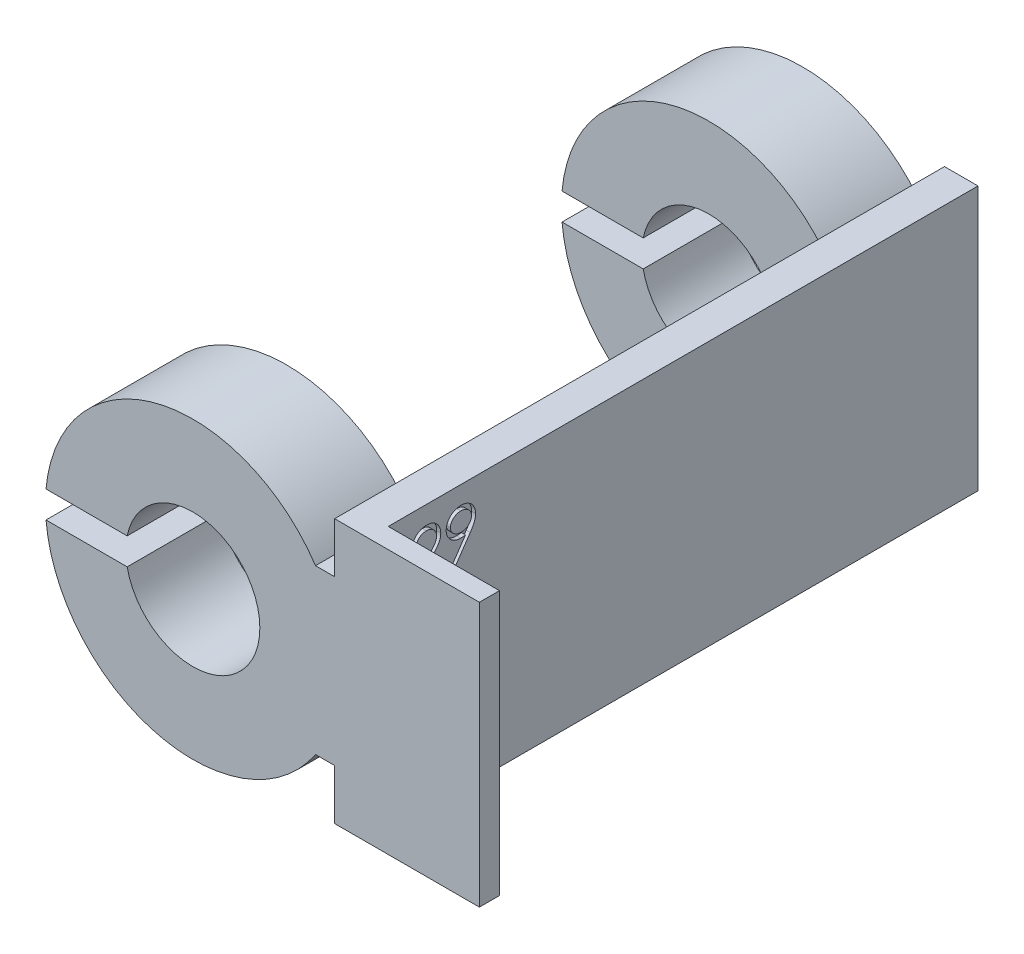
from build123d import *

# Parameters (mm, degrees)
BOSS_EXTRUDE1_DEPTH = 7
SKETCH4_W           = 8.3
SKETCH4_H           = 5.5
CUT_EXTRUDE1_DEPTH  = 24
SKETCH5_W           = 2.5
SKETCH5_H           = 38.5
BOSS_EXTRUDE2_DEPTH = 19.7
BOSS_EXTRUDE3_DEPTH = 7
CUT_EXTRUDE2_DEPTH  = 0.3


with BuildPart() as part:
    # Sketch1 → Boss-Extrude1 (new body)
    with BuildSketch(Plane.XY):
        with BuildLine():
            Line((9.153687781, 6.1), (10.58, 6.1))
            Line((10.58, 6.1), (10.58, 9.85))
            Line((10.58, 9.85), (21.38, 9.85))
            Line((21.38, 9.85), (21.38, -9.85))
            Line((21.38, -9.85), (10.58, -9.85))
            Line((10.58, -9.85), (10.58, -6.1))
            Line((10.58, -6.1), (9.153687781, -6.1))
            ThreePointArc((9.153687781, -6.1), (-2.704290513, -10.662401832), (-10.95445115, -1))
            Line((-10.95445115, -1), (-4.898979486, -1))
            ThreePointArc((-4.898979486, -1), (5, 0), (-4.898979486, 1))
            Line((-4.898979486, 1), (-10.95445115, 1))
            ThreePointArc((-10.95445115, 1), (-2.704290513, 10.662401832), (9.153687781, 6.1))
        make_face()
    extrude(amount=BOSS_EXTRUDE1_DEPTH)

    # Sketch4 → Cut-Extrude1 (cut)
    with BuildSketch(Plane.XZ.offset(9.85)):
        with Locations((17.23, 2.75)):
            Rectangle(SKETCH4_W, SKETCH4_H)
    extrude(amount=-CUT_EXTRUDE1_DEPTH, mode=Mode.SUBTRACT)

    # Sketch5 → Boss-Extrude2 (add)
    with BuildSketch(Plane.XZ.offset(9.85)):
        with Locations((11.83, -19.25)):
            Rectangle(SKETCH5_W, SKETCH5_H)
    extrude(amount=-BOSS_EXTRUDE2_DEPTH)

    # Sketch7 → Boss-Extrude3 (add)
    with BuildSketch(Plane(origin=(0, 0, -38.5), x_dir=(-1, 0, 0), z_dir=(0, 0, -1))):
        with BuildLine():
            Line((-10.58, 6.1), (-10.58, -6.1))
            Line((-10.58, -6.1), (-9.153687781, -6.1))
            ThreePointArc((-9.153687781, -6.1), (2.704290513, -10.662401832), (10.95445115, -1))
            Line((10.95445115, -1), (4.898979486, -1))
            ThreePointArc((4.898979486, -1), (-5, 0), (4.898979486, 1))
            Line((4.898979486, 1), (10.95445115, 1))
            ThreePointArc((10.95445115, 1), (2.704290513, 10.662401832), (-9.153687781, 6.1))
            Line((-9.153687781, 6.1), (-10.58, 6.1))
        make_face()
    extrude(amount=-BOSS_EXTRUDE3_DEPTH)

    # Sketch8 → Cut-Extrude2 (cut)
    # profile 1 of 2: a face of its own
    with BuildSketch(Plane(origin=(13.08, 0, 0), x_dir=(0, 0, -1), z_dir=(1, 0, 0))):
        with BuildLine():
            Line((-3.466201583, 7.336697768), (-3.780304148, 7.336697768))
            add(Edge.make_bspline(
                [(-3.780304148, 7.336697768), (-3.778256995, 7.378368656), (-3.77423644, 7.46020917), (-3.755408151, 7.579533077), (-3.728467274, 7.693587875), (-3.69037582, 7.801457789), (-3.643069542, 7.904096596), (-3.586339515, 8.001096612), (-3.519145664, 8.092087801), (-3.44293893, 8.176226644), (-3.360170291, 8.253414215), (-3.270864352, 8.320069458), (-3.177019324, 8.376387129), (-3.078919926, 8.423468371), (-2.975459362, 8.458808217), (-2.867576504, 8.485029856), (-2.754797368, 8.500806202), (-2.677957346, 8.502501988), (-2.638877865, 8.503364434)],
                knots=[0, 0, 0, 0, 1.10065271, 2.161652631, 3.183658789, 4.190468796, 5.17591951, 6.163126047, 7.15150782, 8.156236427, 9.156009102, 10.134482811, 11.092018607, 12.041330605, 13.001268258, 13.972401359, 14.968799086, 16, 16, 16, 16], degree=3))
            add(Edge.make_bspline(
                [(-2.638877865, 8.503364434), (-2.600499791, 8.502465978), (-2.525088247, 8.500700543), (-2.415026232, 8.485539514), (-2.310248938, 8.461793922), (-2.210961171, 8.428478506), (-2.117955107, 8.383694079), (-2.030532062, 8.32989654), (-1.947651251, 8.267676709), (-1.873044468, 8.194422895), (-1.804536389, 8.116220511), (-1.745434133, 8.032732607), (-1.69482097, 7.946503321), (-1.65263329, 7.85687512), (-1.621577151, 7.763004091), (-1.597998943, 7.666256889), (-1.584671529, 7.565632078), (-1.582626106, 7.497525522), (-1.581586199, 7.462899691)],
                knots=[0, 0, 0, 0, 1.111607364, 2.184268762, 3.212621178, 4.221274766, 5.211760367, 6.196651075, 7.1921475, 8.207485113, 9.220403448, 10.201281604, 11.166441695, 12.114753415, 13.065576456, 14.026450734, 14.996634279, 16, 16, 16, 16], degree=3))
            add(Edge.make_bspline(
                [(-1.581586199, 7.462899691), (-1.583279462, 7.414151856), (-1.586636273, 7.317511643), (-1.61535065, 7.17549678), (-1.660197161, 7.037903361), (-1.714194518, 6.927166059), (-1.768666962, 6.837932565), (-1.817754469, 6.76446386), (-1.87521928, 6.685358392), (-1.941897778, 6.600881054), (-2.01641065, 6.510370149), (-2.099432814, 6.413880354), (-2.191556296, 6.312408584), (-2.256214796, 6.243102983), (-2.289719212, 6.207190556)],
                knots=[0, 0, 0, 0, 1.184426356, 2.348067706, 3.509069118, 4.696110526, 5.333549288, 6.050745305, 6.844228056, 7.710549037, 8.667450064, 9.695053472, 10.805634456, 12, 12, 12, 12], degree=3))
            Line((-2.289719212, 6.207190556), (-3.165420333, 5.272595204))
            Line((-3.165420333, 5.272595204), (-1.536714404, 5.272595204))
            Line((-1.536714404, 5.272595204), (-1.536714404, 4.913620845))
            Line((-1.536714404, 4.913620845), (-3.914919532, 4.913620845))
            Line((-3.914919532, 4.913620845), (-2.557547737, 6.362138473))
            add(Edge.make_bspline(
                [(-2.557547737, 6.362138473), (-2.52449985, 6.396636779), (-2.461021623, 6.462900966), (-2.371239047, 6.559643926), (-2.290600058, 6.649393467), (-2.218582665, 6.731980015), (-2.15674916, 6.808611583), (-2.101876928, 6.876806287), (-2.057911337, 6.939560737), (-2.010195941, 7.012301351), (-1.96398196, 7.101113668), (-1.924269604, 7.209647357), (-1.900054756, 7.32137461), (-1.89714992, 7.396876647), (-1.895688763, 7.434854819)],
                knots=[0, 0, 0, 0, 1.329631726, 2.553950428, 3.673215718, 4.687767853, 5.603093632, 6.413772471, 7.123043292, 7.734684054, 8.834405432, 9.900288307, 10.943827018, 12, 12, 12, 12], degree=3))
            add(Edge.make_bspline(
                [(-1.895688763, 7.434854819), (-1.896324505, 7.458736217), (-1.897577431, 7.505801868), (-1.908635129, 7.574807627), (-1.925345635, 7.641372441), (-1.949290893, 7.70570106), (-1.980897633, 7.767146712), (-2.019371013, 7.825784192), (-2.063761076, 7.882473157), (-2.115112346, 7.935626455), (-2.171523865, 7.984307661), (-2.231118115, 8.027431746), (-2.294168219, 8.063470857), (-2.360408341, 8.093014354), (-2.429653811, 8.116189735), (-2.502038556, 8.132248315), (-2.577362572, 8.142330799), (-2.628796068, 8.143694971), (-2.655003667, 8.144390075)],
                knots=[0, 0, 0, 0, 0.991446411, 1.95395049, 2.89581595, 3.838931463, 4.798493298, 5.75982156, 6.748411868, 7.785213223, 8.824556874, 9.840280684, 10.836137867, 11.835679398, 12.848801643, 13.863922112, 14.911575587, 16, 16, 16, 16], degree=3))
            add(Edge.make_bspline(
                [(-2.655003667, 8.144390075), (-2.6823745, 8.143675043), (-2.736126296, 8.142270838), (-2.815045329, 8.132448174), (-2.890331106, 8.115502334), (-2.962173009, 8.092325659), (-3.030692595, 8.06286711), (-3.095556639, 8.026175366), (-3.156619528, 7.982391872), (-3.213996052, 7.932751316), (-3.266860031, 7.877483715), (-3.313306907, 7.815873752), (-3.353890921, 7.749046337), (-3.389300154, 7.677181786), (-3.418055844, 7.599628006), (-3.440028995, 7.516660301), (-3.457415841, 7.42863892), (-3.463224362, 7.367853835), (-3.466201583, 7.336697768)],
                knots=[0, 0, 0, 0, 1.031018746, 2.02475058, 2.990194455, 3.934040569, 4.864654155, 5.795059489, 6.735614925, 7.690564532, 8.649604399, 9.611025574, 10.590972636, 11.591080095, 12.624614302, 13.701020113, 14.821632451, 16, 16, 16, 16], degree=3))
        make_face()
    # profile 2 of 2: a face of its own
    with BuildSketch(Plane(origin=(13.08, 0, 0), x_dir=(0, 0, -1), z_dir=(1, 0, 0))):
        with BuildLine():
            Line((-0.459791327, 4.823877255), (-0.71079293, 4.998456582))
            Line((-0.71079293, 4.998456582), (0.262364122, 6.421032704))
            add(Edge.make_bspline(
                [(0.262364122, 6.421032704), (0.200273386, 6.41343964), (0.078013266, 6.398488475), (-0.045123836, 6.395741821), (-0.105724821, 6.394390075)],
                knots=[0, 0, 0, 0, 1.015715272, 2, 2, 2, 2], degree=3))
            add(Edge.make_bspline(
                [(-0.105724821, 6.394390075), (-0.142466868, 6.395331152), (-0.214588295, 6.397178403), (-0.320619948, 6.411820211), (-0.422505508, 6.434370339), (-0.519974864, 6.468019094), (-0.613394369, 6.509837303), (-0.702560082, 6.561694317), (-0.787351973, 6.622700608), (-0.866859383, 6.6925336), (-0.939171122, 6.769211652), (-1.00359442, 6.850367295), (-1.057135552, 6.936943266), (-1.101612137, 7.027173485), (-1.135342591, 7.122354836), (-1.159905128, 7.221404236), (-1.175027482, 7.325015878), (-1.176826578, 7.395541009), (-1.177740045, 7.43134921)],
                knots=[0, 0, 0, 0, 1.060718605, 2.082097864, 3.085795603, 4.069760067, 5.054557537, 6.03741023, 7.043284206, 8.066802108, 9.088538119, 10.083643548, 11.053783639, 12.022749082, 12.983451788, 13.964007469, 14.966251758, 16, 16, 16, 16], degree=3))
            add(Edge.make_bspline(
                [(-1.177740045, 7.43134921), (-1.17600561, 7.480317863), (-1.172601267, 7.576433394), (-1.145202749, 7.716867163), (-1.10014241, 7.849653707), (-1.037314033, 7.974443901), (-0.958179312, 8.08944264), (-0.863070722, 8.193051249), (-0.752566757, 8.283796103), (-0.629184738, 8.361800181), (-0.495831718, 8.424535178), (-0.356163059, 8.470774478), (-0.211248939, 8.497973226), (-0.113081269, 8.501559087), (-0.063657513, 8.503364434)],
                knots=[0, 0, 0, 0, 1.022988612, 2.007919123, 2.978103895, 3.94594894, 4.918897164, 5.887013414, 6.875921846, 7.89917871, 8.930658928, 9.948724884, 10.967259574, 12, 12, 12, 12], degree=3))
            add(Edge.make_bspline(
                [(-0.063657513, 8.503364434), (-0.015169093, 8.501534271), (0.080639454, 8.497918042), (0.22152846, 8.471434073), (0.356469477, 8.4267974), (0.484714464, 8.365112836), (0.603453876, 8.287791928), (0.710229687, 8.195657405), (0.802605226, 8.088651877), (0.880429107, 7.969363387), (0.942899147, 7.841196406), (0.98797143, 7.707412484), (1.015717069, 7.568973762), (1.019213396, 7.475179288), (1.020977904, 7.427843601)],
                knots=[0, 0, 0, 0, 1.026385292, 2.028040595, 3.023318987, 4.028184125, 5.03290303, 6.015178782, 7.004435299, 8.016004309, 9.023023918, 10.015172535, 10.998308025, 12, 12, 12, 12], degree=3))
            add(Edge.make_bspline(
                [(1.020977904, 7.427843601), (1.019799495, 7.391099834), (1.017409387, 7.316574293), (1.00067308, 7.20334395), (0.972252895, 7.087892721), (0.940001196, 6.990171125), (0.908869028, 6.909462675), (0.879567897, 6.845711096), (0.847055743, 6.778609832), (0.809136978, 6.708862494), (0.768374681, 6.635579959), (0.722315404, 6.559497244), (0.672009833, 6.48051225), (0.636180113, 6.427265162), (0.617832872, 6.39999905)],
                knots=[0, 0, 0, 0, 1.179839688, 2.393009684, 3.667231171, 4.993948276, 5.694988576, 6.444077775, 7.246288328, 8.089075292, 8.993003841, 9.939041771, 10.944649915, 12, 12, 12, 12], degree=3))
            Line((0.617832872, 6.39999905), (-0.459791327, 4.823877255))
        make_face()
        with BuildLine():
            add(Edge.make_bspline(
                [(-0.047531712, 6.753364434), (-0.019697698, 6.754124818), (0.034485666, 6.755605027), (0.113862965, 6.764614269), (0.188787168, 6.780588255), (0.259458417, 6.803507967), (0.326585319, 6.831164636), (0.389101647, 6.866376622), (0.447059723, 6.908393257), (0.50084765, 6.955603273), (0.548611649, 7.008053856), (0.59115468, 7.062950963), (0.627315248, 7.120535573), (0.655878525, 7.181528835), (0.6793631, 7.244446043), (0.695581112, 7.310300399), (0.704565445, 7.378748799), (0.70609702, 7.425247457), (0.70687534, 7.448877255)],
                knots=[0, 0, 0, 0, 1.163407946, 2.26475976, 3.333800367, 4.359385343, 5.366239384, 6.363380779, 7.350133999, 8.353570782, 9.349036268, 10.310270964, 11.253520213, 12.184142, 13.120487599, 14.056272588, 15.012232024, 16, 16, 16, 16], degree=3))
            add(Edge.make_bspline(
                [(0.70687534, 7.448877255), (0.70620567, 7.47251692), (0.704886005, 7.51910178), (0.694298706, 7.58765152), (0.675673482, 7.653344781), (0.650682998, 7.716541211), (0.61776276, 7.776721583), (0.578259274, 7.834641455), (0.531326824, 7.889933582), (0.477324258, 7.941297566), (0.419089705, 7.988645465), (0.357029205, 8.030431541), (0.291654289, 8.065452737), (0.223363799, 8.094351707), (0.15201545, 8.116903483), (0.077651462, 8.133120848), (-0.000103944, 8.142092602), (-0.05288523, 8.143614497), (-0.079783314, 8.144390075)],
                knots=[0, 0, 0, 0, 0.972161553, 1.915763587, 2.844109794, 3.775983486, 4.705125789, 5.659731448, 6.655561913, 7.682237399, 8.721216875, 9.739758359, 10.754845918, 11.767244016, 12.7857855, 13.828538656, 14.893392813, 16, 16, 16, 16], degree=3))
            add(Edge.make_bspline(
                [(-0.079783314, 8.144390075), (-0.106447468, 8.143613244), (-0.158762317, 8.142089106), (-0.235826476, 8.133137901), (-0.309687644, 8.116794417), (-0.380829264, 8.094362153), (-0.449117725, 8.065450582), (-0.514489558, 8.030429706), (-0.576564574, 7.988655084), (-0.634743295, 7.941260311), (-0.688841217, 7.890172665), (-0.734966746, 7.834399236), (-0.774560638, 7.776751712), (-0.807435641, 7.716533204), (-0.832438158, 7.653346918), (-0.85106016, 7.587650941), (-0.861648325, 7.519101931), (-0.862967872, 7.472516971), (-0.863637481, 7.448877255)],
                knots=[0, 0, 0, 0, 1.099389452, 2.15699305, 3.192601482, 4.213358962, 5.227959689, 6.245255729, 7.266013209, 8.307253147, 9.336162325, 10.327954924, 11.284637477, 12.215801273, 13.149702402, 14.080068371, 15.025723358, 16, 16, 16, 16], degree=3))
            add(Edge.make_bspline(
                [(-0.863637481, 7.448877255), (-0.863031555, 7.425229056), (-0.861836558, 7.37859048), (-0.850308768, 7.310064087), (-0.831030488, 7.244375893), (-0.805211097, 7.180887186), (-0.771209507, 7.120215328), (-0.729485659, 7.062647966), (-0.680580113, 7.007532516), (-0.625146626, 6.955725304), (-0.564478465, 6.908173129), (-0.499681719, 6.866642747), (-0.431871882, 6.831570302), (-0.360810251, 6.803428918), (-0.287023451, 6.780817255), (-0.20984832, 6.764643709), (-0.129540082, 6.755691443), (-0.0751301, 6.754147546), (-0.047531712, 6.753364434)],
                knots=[0, 0, 0, 0, 0.952633368, 1.87876736, 2.791047057, 3.707742249, 4.635551637, 5.587206343, 6.568248508, 7.601284464, 8.641511608, 9.671105535, 10.699146789, 11.713763218, 12.747829548, 13.806491675, 14.887386225, 16, 16, 16, 16], degree=3))
        make_face(mode=Mode.SUBTRACT)
    extrude(amount=-CUT_EXTRUDE2_DEPTH, mode=Mode.SUBTRACT)


solid = part.part
